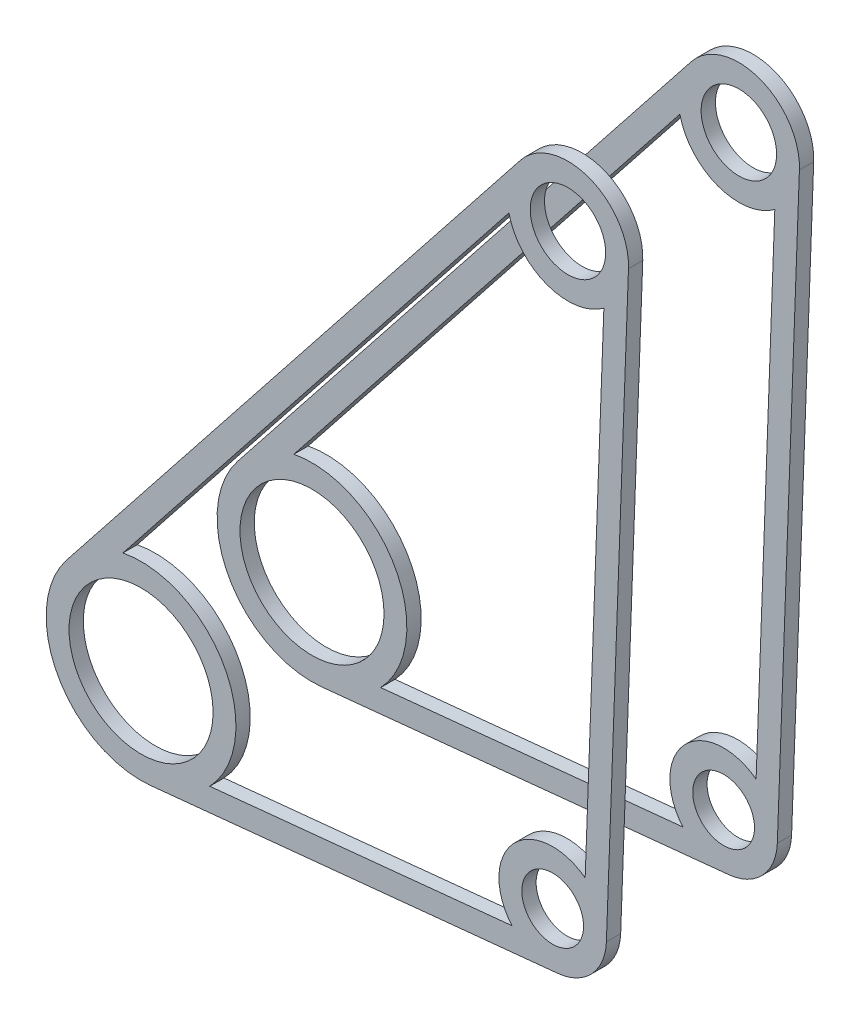
from build123d import *

# Parameters (mm, degrees)
BOSS_EXTRUDE1_START = 8.6995
SKETCH1_R           = 3.429
SKETCH1_R_2         = 4.191
SKETCH1_R_3         = 8.001
BOSS_EXTRUDE1_DEPTH = 1.5875
BOSS_EXTRUDE2_START = -8.6995
SKETCH1_4_R         = 3.429
SKETCH1_4_R_2       = 4.191
SKETCH1_4_R_3       = 8.001
BOSS_EXTRUDE2_DEPTH = 1.5875


with BuildPart() as part:
    # Sketch1 → Boss-Extrude1 (new body)
    with BuildSketch(Plane.XY.offset(BOSS_EXTRUDE1_START)):
        with BuildLine():
            ThreePointArc((54.139680923, 65.768068925), (49.743182937, 72.33320285), (42.136254402, 70.196659792))
            Line((42.136254402, 70.196659792), (-8.264104742, 6.543489422))
            ThreePointArc((-8.264104742, 6.543489422), (-9.247450164, -5.059382025), (1.0541, -10.488162575))
            Line((1.0541, -10.488162575), (46.3169, -5.939080012))
            ThreePointArc((46.3169, -5.939080012), (50.071526337, -4.085728764), (51.684874278, -0.221891526))
            Line((51.684874278, -0.221891526), (54.139680923, 65.768068925))
        make_face()
        with BuildLine():
            Line((-2.01262532, 10.347077864), (40.857998083, 64.490562984))
            ThreePointArc((40.857998083, 64.490562984), (45.083483729, 59.703371208), (51.405639077, 60.599075292))
            Line((51.405639077, 60.599075292), (49.328254105, 4.754940937))
            ThreePointArc((49.328254105, 4.754940937), (41.368473663, 4.085728764), (41.201602766, -3.900390677))
            Line((41.201602766, -3.900390677), (7.628402366, -7.274624275))
            ThreePointArc((7.628402366, -7.274624275), (9.247450164, 5.059382025), (-2.01262532, 10.347077864))
        make_face(mode=Mode.SUBTRACT)
        with Locations((45.72, 0)):
            Circle(SKETCH1_R, mode=Mode.SUBTRACT)
        with Locations((47.413333333, 66.018287029)):
            Circle(SKETCH1_R_2, mode=Mode.SUBTRACT)
        Circle(SKETCH1_R_3, mode=Mode.SUBTRACT)
    extrude(amount=BOSS_EXTRUDE1_DEPTH)


with BuildPart() as body_2:
    # Sketch1<4> → Boss-Extrude2 (new body)
    with BuildSketch(Plane.XY.offset(BOSS_EXTRUDE2_START)):
        with BuildLine():
            ThreePointArc((54.139680923, 65.768068925), (49.743182937, 72.33320285), (42.136254402, 70.196659792))
            Line((42.136254402, 70.196659792), (-8.264104742, 6.543489422))
            ThreePointArc((-8.264104742, 6.543489422), (-9.247450164, -5.059382025), (1.0541, -10.488162575))
            Line((1.0541, -10.488162575), (46.3169, -5.939080012))
            ThreePointArc((46.3169, -5.939080012), (50.071526337, -4.085728764), (51.684874278, -0.221891526))
            Line((51.684874278, -0.221891526), (54.139680923, 65.768068925))
        make_face()
        with BuildLine():
            Line((-2.01262532, 10.347077864), (40.857998083, 64.490562984))
            ThreePointArc((40.857998083, 64.490562984), (45.083483729, 59.703371208), (51.405639077, 60.599075292))
            Line((51.405639077, 60.599075292), (49.328254105, 4.754940937))
            ThreePointArc((49.328254105, 4.754940937), (41.368473663, 4.085728764), (41.201602766, -3.900390677))
            Line((41.201602766, -3.900390677), (7.628402366, -7.274624275))
            ThreePointArc((7.628402366, -7.274624275), (9.247450164, 5.059382025), (-2.01262532, 10.347077864))
        make_face(mode=Mode.SUBTRACT)
        with Locations((45.72, 0)):
            Circle(SKETCH1_4_R, mode=Mode.SUBTRACT)
        with Locations((47.413333333, 66.018287029)):
            Circle(SKETCH1_4_R_2, mode=Mode.SUBTRACT)
        Circle(SKETCH1_4_R_3, mode=Mode.SUBTRACT)
    extrude(amount=-BOSS_EXTRUDE2_DEPTH)


solid = Compound([part.part, body_2.part])
